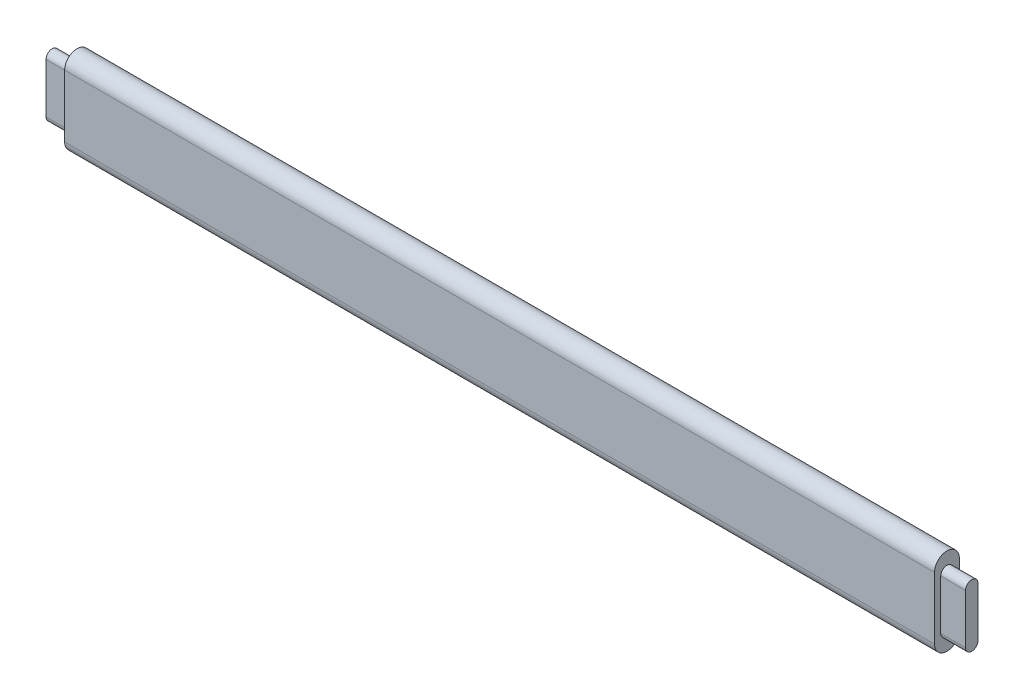
from build123d import *

# Parameters (mm, degrees)
BOSS_EXTRUDE1_DEPTH = 444.5
BOSS_EXTRUDE2_DEPTH = 25.4


with BuildPart() as part:
    # Sketch1 → Boss-Extrude1 (new, symmetric)
    with BuildSketch(Plane(origin=(0, 0, 0), x_dir=(0, 0, -1), z_dir=(1, 0, 0))):
        with BuildLine():
            Line((12.7, 31.75), (12.7, -31.75))
            ThreePointArc((12.7, -31.75), (0, -44.45), (-12.7, -31.75))
            Line((-12.7, -31.75), (-12.7, 31.75))
            ThreePointArc((-12.7, 31.75), (0, 44.45), (12.7, 31.75))
        make_face()
    extrude(amount=BOSS_EXTRUDE1_DEPTH, both=True)

    # Sketch2 → Boss-Extrude2 (add)
    with BuildSketch(Plane(origin=(444.5, 0, 0), x_dir=(0, 0, -1), z_dir=(1, 0, 0))):
        with BuildLine():
            Line((-6.35, -25.4), (-6.35, 25.4))
            ThreePointArc((-6.35, 25.4), (0, 31.75), (6.35, 25.4))
            Line((6.35, 25.4), (6.35, -25.4))
            ThreePointArc((6.35, -25.4), (0, -31.75), (-6.35, -25.4))
        make_face()
    boss_extrude2 = extrude(amount=BOSS_EXTRUDE2_DEPTH)

    # Mirror1: Boss-Extrude2 across plane
    add(boss_extrude2.mirror(Plane(origin=(0, 0, 0), x_dir=(0, 0, 1), z_dir=(1, 0, 0))))


solid = part.part
